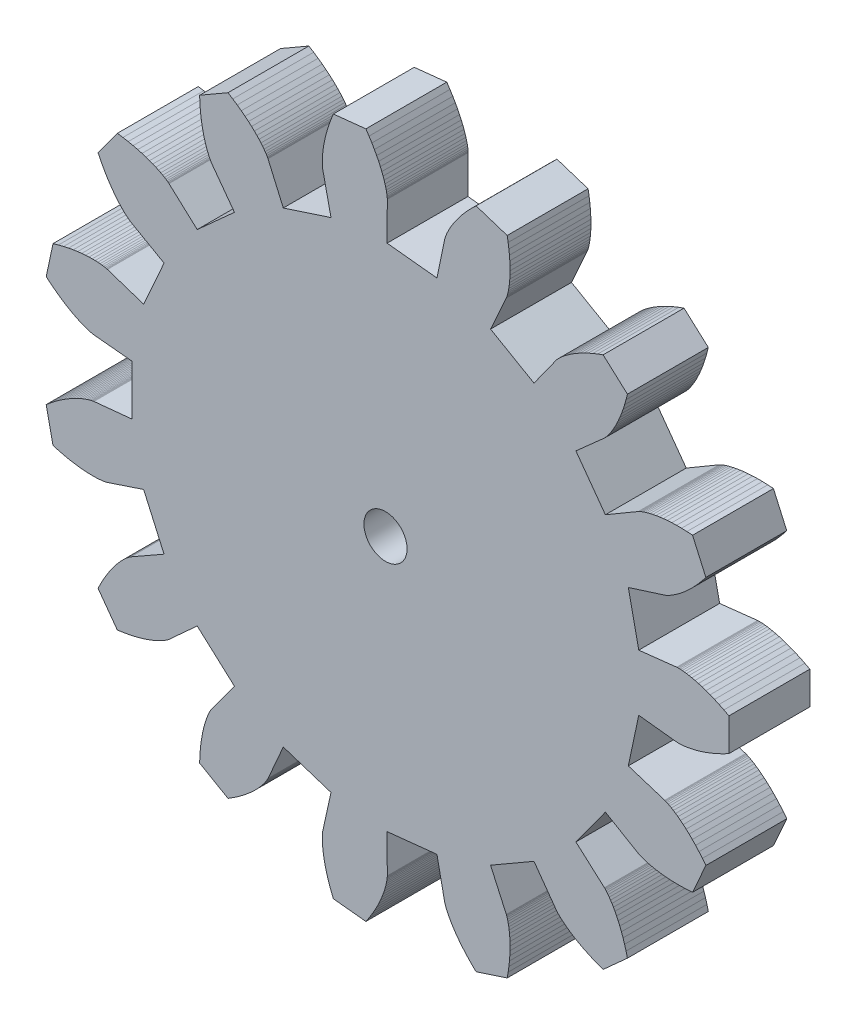
from build123d import *

# Parameters (mm, degrees)
BOSS_EXTRUDE1_DEPTH = 6
SKETCH2_R           = 1.6
CUT_EXTRUDE1_DEPTH  = 6


with BuildPart() as part:
    # Model → Boss-Extrude1 (new body)
    with BuildSketch(Plane.XY):
        Polygon((18.783959384, 2.091140805), (21.59989463, 2.404627274), (21.611187175, 2.405638786), (21.645137529, 2.407699472), (21.701801628, 2.409345407), (21.781164458, 2.409110911), (21.883140018, 2.405531605), (22.007571419, 2.397147466), (22.154231094, 2.382505881), (22.322821142, 2.360164681), (22.512973788, 2.328695174), (22.724251968, 2.286685142), (22.956150034, 2.232741827), (23.208094576, 2.165494884), (23.479445371, 2.083599295), (23.769496443, 1.98573825), (24.077477235, 1.870625985), (24.402553913, 1.737010572), (24.743830758, 1.583676654), (25.10035169, 1.409448127), (25.471101886, 1.213190763), (25.471101886, -1.213190763), (25.10035169, -1.409448127), (24.743830758, -1.583676654), (24.402553913, -1.737010572), (24.077477235, -1.870625985), (23.769496443, -1.98573825), (23.479445371, -2.083599295), (23.208094576, -2.165494884), (22.956150034, -2.232741827), (22.724251968, -2.286685142), (22.512973788, -2.328695174), (22.322821142, -2.360164681), (22.154231094, -2.382505881), (22.007571419, -2.397147466), (21.883140018, -2.405531605), (21.781164458, -2.409110911), (21.701801628, -2.409345407), (21.645137529, -2.407699472), (21.611187175, -2.405638786), (21.59989463, -2.404627274), (18.783959384, -2.091140805), (18.010544363, -5.7297724), (20.71053565, -6.588732309), (20.721263323, -6.592401339), (20.75311667, -6.604327661), (20.805551363, -6.62587139), (20.877957537, -6.658365384), (20.969661012, -6.70311244), (21.079924617, -6.761382542), (21.207949627, -6.83441016), (21.352877315, -6.923391611), (21.5137906, -7.029482486), (21.689715802, -7.153795138), (21.879624504, -7.297396248), (22.0824355, -7.461304465), (22.29701685, -7.64648812), (22.522188015, -7.853863033), (22.756722094, -8.084290393), (22.999348131, -8.338574743), (23.248753519, -8.617462046), (23.503586471, -8.921637852), (23.762458567, -9.251725566), (22.775560291, -11.468335387), (22.357038072, -11.49682772), (21.960474868, -11.510983273), (21.586336433, -11.512250979), (21.235017826, -11.502094136), (20.906842996, -11.481987349), (20.602064484, -11.453413463), (20.320863261, -11.417860495), (20.063348673, -11.376818557), (19.829558526, -11.331776786), (19.619459284, -11.284220283), (19.432946396, -11.235627059), (19.269844739, -11.18746501), (19.12990919, -11.1411889), (19.012825313, -11.098237382), (18.918210168, -11.060030044), (18.845613237, -11.027964496), (18.794517468, -11.003413494), (18.764340434, -10.98772211), (18.754435599, -10.982204956), (16.30945718, -9.550476767), (14.122942601, -12.559955903), (16.240136907, -14.442840219), (16.248444795, -14.450555382), (16.272693403, -14.474406543), (16.311832255, -14.51541483), (16.364762088, -14.574549815), (16.430337114, -14.652727449), (16.507367343, -14.750808084), (16.594621002, -14.869594595), (16.690827016, -15.009830597), (16.79467757, -15.172198763), (16.904830729, -15.357319248), (17.019913127, -15.565748218), (17.138522714, -15.797976488), (17.259231553, -16.054428273), (17.380588672, -16.335460046), (17.501122963, -16.641359518), (17.619346115, -16.972344731), (17.733755589, -17.328563271), (17.842837628, -17.710091596), (17.945070287, -18.116934495), (16.141917412, -19.740500637), (15.747989464, -19.596301355), (15.379953368, -19.44793631), (15.037645278, -19.296918606), (14.720830921, -19.144745718), (14.429206462, -18.992896525), (14.162399484, -18.842828392), (13.919970078, -18.695974298), (13.701412056, -18.553740003), (13.506154268, -18.417501278), (13.333562033, -18.28860119), (13.182938676, -18.168347446), (13.053527168, -18.058009804), (12.944511873, -17.958817559), (12.855020385, -17.871957091), (12.784125473, -17.798569504), (12.73084711, -17.739748337), (12.694154595, -17.696537359), (12.672968763, -17.669928461), (12.666164275, -17.660859631), (11.014901664, -15.358448533), (7.79335576, -17.218408927), (8.961670955, -19.799649846), (8.966122549, -19.810077121), (8.978573614, -19.841729038), (8.997649161, -19.895111177), (9.021950605, -19.970662177), (9.050058664, -20.068752765), (9.080536291, -20.189684901), (9.111931648, -20.333691039), (9.142781095, -20.500933513), (9.171612214, -20.691504039), (9.196946847, -20.905423343), (9.21730415, -21.14264091), (9.231203652, -21.403034857), (9.237168325, -21.686411928), (9.233727651, -21.992507615), (9.21942068, -22.320986401), (9.192799089, -22.671442127), (9.152430211, -23.043398481), (9.096900062, -23.436309612), (9.024816329, -23.849560863), (6.717190368, -24.599353989), (6.415970411, -24.307396459), (6.140098209, -24.02216448), (5.888808642, -23.744973699), (5.661278615, -23.47709684), (5.456629046, -23.219761346), (5.273926952, -22.974147111), (5.11218761, -22.741384298), (4.970376822, -22.522551247), (4.847413238, -22.318672482), (4.742170775, -22.130716806), (4.653481095, -21.959595505), (4.580136162, -21.806160652), (4.520890855, -21.671203511), (4.474465648, -21.555453058), (4.439549344, -21.459574603), (4.414801862, -21.38416853), (4.398857069, -21.329769147), (4.390325662, -21.296843655), (4.387798079, -21.285791231), (3.815769582, -18.51080502), (0.116226909, -18.899642624), (0.133650682, -21.73292014), (0.13347626, -21.744256556), (0.13197688, -21.778236326), (0.127690787, -21.834762061), (0.119161901, -21.913665621), (0.104942853, -22.01470841), (0.083598021, -22.137581781), (0.053706533, -22.281907576), (0.013865263, -22.447238779), (-0.037308216, -22.63306029), (-0.101172696, -22.838789822), (-0.179060451, -23.063778914), (-0.272274385, -23.307314058), (-0.382085223, -23.568617945), (-0.509728768, -23.846850822), (-0.656403194, -24.141111955), (-0.823266414, -24.450441215), (-1.011433497, -24.773820751), (-1.221974167, -25.110176783), (-1.455910361, -25.458381491), (-3.868999915, -25.204755559), (-4.025428212, -24.81552189), (-4.161435712, -24.442742177), (-4.278256507, -24.087307123), (-4.377160195, -23.750044636), (-4.459449104, -23.431718486), (-4.526455463, -23.133027081), (-4.579538538, -22.854602353), (-4.62008172, -22.59700877), (-4.649489578, -22.360742454), (-4.669184892, -22.146230434), (-4.680605642, -21.953830005), (-4.685201995, -21.783828219), (-4.684433262, -21.636441499), (-4.679764848, -21.511815366), (-4.672665198, -21.410024298), (-4.664602735, -21.331071715), (-4.657042806, -21.274890075), (-4.65144463, -21.241341105), (-4.649258267, -21.230216153), (-4.043143726, -18.462475154), (-7.580998632, -17.312956413), (-8.717479009, -19.908371105), (-8.722249286, -19.918656493), (-8.737439856, -19.949088704), (-8.764346485, -19.998984221), (-8.804230979, -20.0675972), (-8.85831853, -20.154120973), (-8.927795107, -20.257689657), (-9.01380493, -20.377379869), (-9.117448, -20.512212534), (-9.239777716, -20.661154802), (-9.381798561, -20.823122057), (-9.544463874, -20.996980016), (-9.728673706, -21.181546918), (-9.935272765, -21.375595806), (-10.165048452, -21.577856879), (-10.418728994, -21.787019938), (-10.696981674, -22.001736892), (-11.000411165, -22.22062435), (-11.329557962, -22.44226627), (-11.684896923, -22.665216677), (-13.786204963, -21.452025914), (-13.770793728, -21.032818144), (-13.743419592, -20.636947696), (-13.705572239, -20.26472632), (-13.658748242, -19.916393952), (-13.604447991, -19.59211863), (-13.544172606, -19.291996511), (-13.47942087, -19.016052034), (-13.411686159, -18.764238189), (-13.342453407, -18.536436916), (-13.273196072, -18.332459628), (-13.205373142, -18.152047852), (-13.140426164, -17.994873988), (-13.079776312, -17.860542191), (-13.024821488, -17.748589368), (-12.976933478, -17.658486289), (-12.937455143, -17.589638814), (-12.907697672, -17.541389232), (-12.888937889, -17.513017707), (-12.882415621, -17.503743831), (-11.202960752, -15.221815607), (-13.967400637, -12.732702754), (-16.061277383, -14.641483844), (-16.069818692, -14.648939767), (-16.096073864, -14.670562414), (-16.140948627, -14.705200325), (-16.205292339, -14.751658914), (-16.289896164, -14.808702925), (-16.395491355, -14.875058957), (-16.522747632, -14.949418059), (-16.672271673, -15.030438393), (-16.844605708, -15.116747948), (-17.040226224, -15.206947317), (-17.259542784, -15.299612522), (-17.502896962, -15.393297888), (-17.770561387, -15.48653896), (-18.062738912, -15.577855454), (-18.379561899, -15.665754244), (-18.721091624, -15.748732381), (-19.087317808, -15.825280131), (-19.478158259, -15.893884038), (-19.893458653, -15.953029993), (-21.31964993, -13.990046104), (-21.135063904, -13.613349063), (-20.949041371, -13.262837478), (-20.763070019, -12.938190236), (-20.578614632, -12.639017819), (-20.397114228, -12.364863473), (-20.219979261, -12.115204482), (-20.048588876, -11.889453563), (-19.884288221, -11.686960357), (-19.72838583, -11.507013036), (-19.582151069, -11.348840007), (-19.446811659, -11.21161172), (-19.323551272, -11.094442566), (-19.213507211, -10.996392881), (-19.117768166, -10.916471028), (-19.037372068, -10.853635578), (-18.973304024, -10.806797565), (-18.926494348, -10.774822833), (-18.897816694, -10.756534446), (-18.888086281, -10.750715185), (-16.425684089, -9.349165856), (-17.938712183, -5.950849117), (-20.627934986, -6.842951013), (-20.638770457, -6.846288273), (-20.671550473, -6.855362604), (-20.726634116, -6.8687537), (-20.804311433, -6.885024788), (-20.904802762, -6.902725609), (-21.028258199, -6.920395427), (-21.174757165, -6.936566056), (-21.344308112, -6.949764908), (-21.536848345, -6.958518043), (-21.752243967, -6.961353234), (-21.990289949, -6.95680303), (-22.250710324, -6.943407809), (-22.533158504, -6.919718838), (-22.837217719, -6.8843013), (-23.162401578, -6.835737322), (-23.508154757, -6.772628968), (-23.873853798, -6.693601209), (-24.25880804, -6.597304863), (-24.662260655, -6.482419494), (-25.166733741, -4.109060226), (-24.844889526, -3.840008256), (-24.53238358, -3.595462171), (-24.230444367, -3.374523521), (-23.940251601, -3.176240683), (-23.662934113, -2.999611091), (-23.399567809, -2.843583536), (-23.15117373, -2.707060558), (-22.918716206, -2.588900907), (-22.703101115, -2.487922064), (-22.505174247, -2.402902848), (-22.325719771, -2.332586067), (-22.165458817, -2.275681235), (-22.025048164, -2.230867342), (-21.905079049, -2.196795674), (-21.806076078, -2.172092673), (-21.728496271, -2.155362841), (-21.672728209, -2.145191679), (-21.639091312, -2.140148659), (-21.62783523, -2.138790215), (-18.808257424, -1.859960394), (-18.808257424, 1.859960394), (-21.62783523, 2.138790215), (-21.639091312, 2.140148659), (-21.672728209, 2.145191679), (-21.728496271, 2.155362841), (-21.806076078, 2.172092673), (-21.905079049, 2.196795674), (-22.025048164, 2.230867342), (-22.165458817, 2.275681235), (-22.325719771, 2.332586067), (-22.505174247, 2.402902848), (-22.703101115, 2.487922064), (-22.918716206, 2.588900907), (-23.15117373, 2.707060558), (-23.399567809, 2.843583536), (-23.662934113, 2.999611091), (-23.940251601, 3.176240683), (-24.230444367, 3.374523521), (-24.53238358, 3.595462171), (-24.844889526, 3.840008256), (-25.166733741, 4.109060226), (-24.662260655, 6.482419494), (-24.25880804, 6.597304863), (-23.873853798, 6.693601209), (-23.508154757, 6.772628968), (-23.162401578, 6.835737322), (-22.837217719, 6.8843013), (-22.533158504, 6.919718838), (-22.250710324, 6.943407809), (-21.990289949, 6.95680303), (-21.752243967, 6.961353234), (-21.536848345, 6.958518043), (-21.344308112, 6.949764908), (-21.174757165, 6.936566056), (-21.028258199, 6.920395427), (-20.904802762, 6.902725609), (-20.804311433, 6.885024788), (-20.726634116, 6.8687537), (-20.671550473, 6.855362604), (-20.638770457, 6.846288273), (-20.627934986, 6.842951013), (-17.938712183, 5.950849117), (-16.425684089, 9.349165856), (-18.888086281, 10.750715185), (-18.897816694, 10.756534446), (-18.926494348, 10.774822833), (-18.973304024, 10.806797565), (-19.037372068, 10.853635578), (-19.117768166, 10.916471028), (-19.213507211, 10.996392881), (-19.323551272, 11.094442566), (-19.446811659, 11.21161172), (-19.582151069, 11.348840007), (-19.72838583, 11.507013036), (-19.884288221, 11.686960357), (-20.048588876, 11.889453563), (-20.219979261, 12.115204482), (-20.397114228, 12.364863473), (-20.578614632, 12.639017819), (-20.763070019, 12.938190236), (-20.949041371, 13.262837478), (-21.135063904, 13.613349063), (-21.31964993, 13.990046104), (-19.893458653, 15.953029993), (-19.478158259, 15.893884038), (-19.087317808, 15.825280131), (-18.721091624, 15.748732381), (-18.379561899, 15.665754244), (-18.062738912, 15.577855454), (-17.770561387, 15.48653896), (-17.502896962, 15.393297888), (-17.259542784, 15.299612522), (-17.040226224, 15.206947317), (-16.844605708, 15.116747948), (-16.672271673, 15.030438393), (-16.522747632, 14.949418059), (-16.395491355, 14.875058957), (-16.289896164, 14.808702925), (-16.205292339, 14.751658914), (-16.140948627, 14.705200325), (-16.096073864, 14.670562414), (-16.069818692, 14.648939767), (-16.061277383, 14.641483844), (-13.967400637, 12.732702754), (-11.202960752, 15.221815607), (-12.882415621, 17.503743831), (-12.888937889, 17.513017707), (-12.907697672, 17.541389232), (-12.937455143, 17.589638814), (-12.976933478, 17.658486289), (-13.024821488, 17.748589368), (-13.079776312, 17.860542191), (-13.140426164, 17.994873988), (-13.205373142, 18.152047852), (-13.273196072, 18.332459628), (-13.342453407, 18.536436916), (-13.411686159, 18.764238189), (-13.47942087, 19.016052034), (-13.544172606, 19.291996511), (-13.604447991, 19.59211863), (-13.658748242, 19.916393952), (-13.705572239, 20.26472632), (-13.743419592, 20.636947696), (-13.770793728, 21.032818144), (-13.786204963, 21.452025914), (-11.684896923, 22.665216677), (-11.329557962, 22.44226627), (-11.000411165, 22.22062435), (-10.696981674, 22.001736892), (-10.418728994, 21.787019938), (-10.165048452, 21.577856879), (-9.935272765, 21.375595806), (-9.728673706, 21.181546918), (-9.544463874, 20.996980016), (-9.381798561, 20.823122057), (-9.239777716, 20.661154802), (-9.117448, 20.512212534), (-9.01380493, 20.377379869), (-8.927795107, 20.257689657), (-8.85831853, 20.154120973), (-8.804230979, 20.0675972), (-8.764346485, 19.998984221), (-8.737439857, 19.949088704), (-8.722249286, 19.918656493), (-8.717479009, 19.908371105), (-7.580998632, 17.312956413), (-4.043143726, 18.462475154), (-4.649258267, 21.230216153), (-4.65144463, 21.241341105), (-4.657042806, 21.274890075), (-4.664602735, 21.331071715), (-4.672665198, 21.410024298), (-4.679764848, 21.511815366), (-4.684433262, 21.636441499), (-4.685201995, 21.783828219), (-4.680605642, 21.953830005), (-4.669184892, 22.146230434), (-4.649489578, 22.360742454), (-4.62008172, 22.59700877), (-4.579538538, 22.854602353), (-4.526455463, 23.133027081), (-4.459449104, 23.431718486), (-4.377160195, 23.750044636), (-4.278256507, 24.087307123), (-4.161435712, 24.442742177), (-4.025428212, 24.81552189), (-3.868999915, 25.204755559), (-1.455910361, 25.458381491), (-1.221974167, 25.110176783), (-1.011433497, 24.773820751), (-0.823266414, 24.450441215), (-0.656403194, 24.141111955), (-0.509728768, 23.846850822), (-0.382085223, 23.568617945), (-0.272274385, 23.307314058), (-0.179060451, 23.063778914), (-0.101172696, 22.838789822), (-0.037308216, 22.63306029), (0.013865263, 22.447238779), (0.053706533, 22.281907576), (0.083598021, 22.137581781), (0.104942853, 22.01470841), (0.119161901, 21.913665621), (0.127690787, 21.834762061), (0.13197688, 21.778236326), (0.13347626, 21.744256556), (0.133650682, 21.73292014), (0.116226909, 18.899642624), (3.815769582, 18.51080502), (4.387798079, 21.285791231), (4.390325662, 21.296843655), (4.398857069, 21.329769147), (4.414801862, 21.38416853), (4.439549344, 21.459574603), (4.474465648, 21.555453058), (4.520890855, 21.671203511), (4.580136162, 21.806160652), (4.653481095, 21.959595505), (4.742170775, 22.130716806), (4.847413238, 22.318672482), (4.970376822, 22.522551247), (5.11218761, 22.741384298), (5.273926952, 22.974147111), (5.456629046, 23.219761346), (5.661278615, 23.47709684), (5.888808642, 23.744973699), (6.140098209, 24.02216448), (6.415970411, 24.307396459), (6.717190368, 24.599353989), (9.024816329, 23.849560863), (9.096900062, 23.436309612), (9.152430211, 23.043398481), (9.192799089, 22.671442127), (9.21942068, 22.320986401), (9.233727651, 21.992507615), (9.237168325, 21.686411928), (9.231203652, 21.403034857), (9.21730415, 21.14264091), (9.196946847, 20.905423343), (9.171612214, 20.691504039), (9.142781095, 20.500933513), (9.111931648, 20.333691039), (9.080536291, 20.189684901), (9.050058664, 20.068752765), (9.021950605, 19.970662177), (8.997649161, 19.895111177), (8.978573614, 19.841729038), (8.966122549, 19.810077121), (8.961670955, 19.799649846), (7.79335576, 17.218408927), (11.014901664, 15.358448533), (12.666164275, 17.660859631), (12.672968763, 17.669928461), (12.694154595, 17.696537359), (12.73084711, 17.739748337), (12.784125473, 17.798569504), (12.855020385, 17.871957091), (12.944511873, 17.958817559), (13.053527168, 18.058009804), (13.182938676, 18.168347446), (13.333562033, 18.28860119), (13.506154268, 18.417501278), (13.701412056, 18.553740003), (13.919970078, 18.695974298), (14.162399484, 18.842828392), (14.429206462, 18.992896525), (14.720830921, 19.144745718), (15.037645278, 19.296918606), (15.379953368, 19.44793631), (15.747989464, 19.596301355), (16.141917412, 19.740500637), (17.945070287, 18.116934495), (17.842837628, 17.710091596), (17.733755589, 17.328563271), (17.619346115, 16.972344731), (17.501122963, 16.641359518), (17.380588672, 16.335460046), (17.259231553, 16.054428273), (17.138522714, 15.797976488), (17.019913127, 15.565748218), (16.904830729, 15.357319248), (16.79467757, 15.172198763), (16.690827016, 15.009830597), (16.594621002, 14.869594595), (16.507367343, 14.750808084), (16.430337114, 14.652727449), (16.364762088, 14.574549815), (16.311832255, 14.51541483), (16.272693403, 14.474406543), (16.248444795, 14.450555382), (16.240136907, 14.442840219), (14.122942601, 12.559955903), (16.30945718, 9.550476767), (18.754435599, 10.982204956), (18.764340434, 10.98772211), (18.794517468, 11.003413494), (18.845613237, 11.027964496), (18.918210168, 11.060030044), (19.012825313, 11.098237382), (19.12990919, 11.1411889), (19.269844739, 11.18746501), (19.432946396, 11.235627059), (19.619459284, 11.284220283), (19.829558526, 11.331776786), (20.063348673, 11.376818557), (20.320863261, 11.417860495), (20.602064484, 11.453413463), (20.906842996, 11.481987349), (21.235017826, 11.502094136), (21.586336433, 11.512250979), (21.960474868, 11.510983273), (22.357038072, 11.49682772), (22.775560291, 11.468335387), (23.762458567, 9.251725566), (23.503586471, 8.921637852), (23.248753519, 8.617462046), (22.999348131, 8.338574743), (22.756722094, 8.084290393), (22.522188015, 7.853863033), (22.29701685, 7.64648812), (22.0824355, 7.461304465), (21.879624504, 7.297396248), (21.689715802, 7.153795138), (21.5137906, 7.029482486), (21.352877315, 6.923391611), (21.207949627, 6.83441016), (21.079924617, 6.761382542), (20.969661012, 6.70311244), (20.877957537, 6.658365384), (20.805551363, 6.62587139), (20.75311667, 6.604327661), (20.721263323, 6.592401339), (20.71053565, 6.588732309), (18.010544363, 5.7297724), align=None)
    extrude(amount=BOSS_EXTRUDE1_DEPTH)

    # Sketch2 → Cut-Extrude1 (cut)
    with BuildSketch(Plane.XY.offset(6)):
        Circle(SKETCH2_R)
    extrude(amount=-CUT_EXTRUDE1_DEPTH, mode=Mode.SUBTRACT)


solid = part.part
